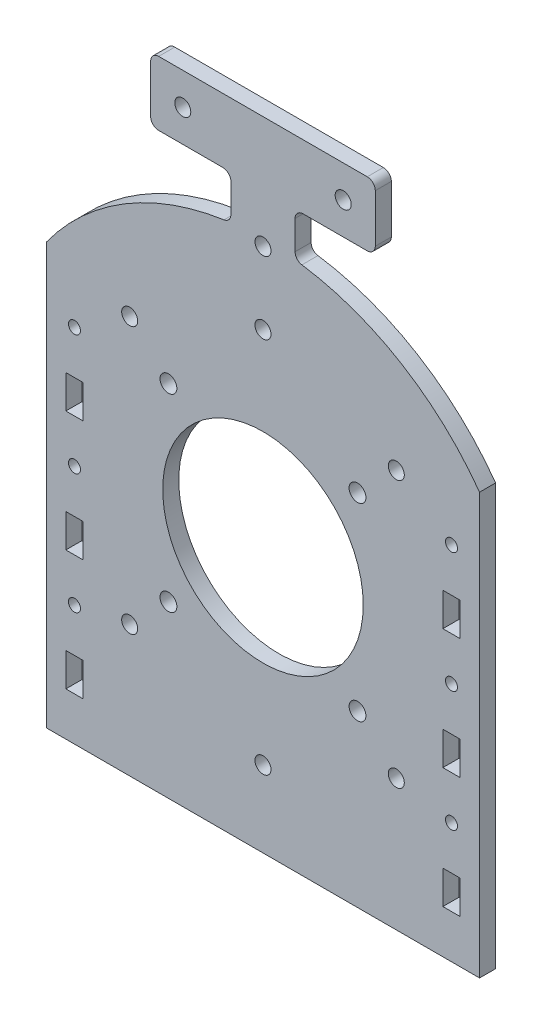
from build123d import *

# Parameters (mm, degrees)
SKETCH_1_R      = 1.5
SKETCH_1_R_2    = 2.1
SKETCH_1_R_3    = 25
SKETCH_1_R_4    = 2
SKETCH_1_W      = 4.3
SKETCH_1_H      = 8.3
EXTRUDE_1_DEPTH = 4
FILLET_1_R      = 2


with BuildPart() as part:
    # 草图1 → 凸台-拉伸1 (new body)
    with BuildSketch(Plane.XY):
        with BuildLine():
            Line((-54, 52.4), (-54, -52.5))
            Line((-54, -52.5), (54, -52.5))
            Line((54, -52.5), (54, 52.4))
            ThreePointArc((54, 52.4), (33.845954515, 70.803240423), (8, 79.569735886))
            Line((8, 79.569735886), (8, 90.5))
            Line((8, 90.5), (28, 90.5))
            Line((28, 90.5), (28, 106.5))
            Line((28, 106.5), (-28, 106.5))
            Line((-28, 106.5), (-28, 90.5))
            Line((-28, 90.5), (-8, 90.5))
            Line((-8, 90.5), (-8, 79.569735886))
            ThreePointArc((-8, 79.569735886), (-33.845954515, 70.803240423), (-54, 52.4))
        make_face()
        with Locations((-47, 37.5)):
            Circle(SKETCH_1_R, mode=Mode.SUBTRACT)
        with Locations((-47, 7.5)):
            Circle(SKETCH_1_R, mode=Mode.SUBTRACT)
        with Locations((-47, -22.5)):
            Circle(SKETCH_1_R, mode=Mode.SUBTRACT)
        with Locations((-23.57, 37.07)):
            Circle(SKETCH_1_R_2, mode=Mode.SUBTRACT)
        with Locations((-23.57, -10.07)):
            Circle(SKETCH_1_R_2, mode=Mode.SUBTRACT)
        with Locations((23.57, -10.07)):
            Circle(SKETCH_1_R_2, mode=Mode.SUBTRACT)
        with Locations((23.57, 37.07)):
            Circle(SKETCH_1_R_2, mode=Mode.SUBTRACT)
        with Locations((47, -22.5)):
            Circle(SKETCH_1_R, mode=Mode.SUBTRACT)
        with Locations((47, 7.5)):
            Circle(SKETCH_1_R, mode=Mode.SUBTRACT)
        with Locations((47, 37.5)):
            Circle(SKETCH_1_R, mode=Mode.SUBTRACT)
        with Locations((0, 13.5)):
            Circle(SKETCH_1_R_3, mode=Mode.SUBTRACT)
        with Locations((0, 60.5)):
            Circle(SKETCH_1_R_4, mode=Mode.SUBTRACT)
        with Locations((33.234018716, 46.734018716)):
            Circle(SKETCH_1_R_4, mode=Mode.SUBTRACT)
        with Locations((33.234018716, -19.734018716)):
            Circle(SKETCH_1_R_4, mode=Mode.SUBTRACT)
        with Locations((0, -33.5)):
            Circle(SKETCH_1_R_4, mode=Mode.SUBTRACT)
        with Locations((-33.234018716, -19.734018716)):
            Circle(SKETCH_1_R_4, mode=Mode.SUBTRACT)
        with Locations((-33.234018716, 46.734018716)):
            Circle(SKETCH_1_R_4, mode=Mode.SUBTRACT)
        with Locations((0, 78.5)):
            Circle(SKETCH_1_R_4, mode=Mode.SUBTRACT)
        with Locations((-20, 98.5)):
            Circle(SKETCH_1_R_4, mode=Mode.SUBTRACT)
        with Locations((20, 98.5)):
            Circle(SKETCH_1_R_4, mode=Mode.SUBTRACT)
        with Locations((-47, 22.5)):
            Rectangle(SKETCH_1_W, SKETCH_1_H, mode=Mode.SUBTRACT)
        with Locations((-47, -7.5)):
            Rectangle(SKETCH_1_W, SKETCH_1_H, mode=Mode.SUBTRACT)
        with Locations((-47, -37.5)):
            Rectangle(SKETCH_1_W, SKETCH_1_H, mode=Mode.SUBTRACT)
        with Locations((47, -37.5)):
            Rectangle(SKETCH_1_W, SKETCH_1_H, mode=Mode.SUBTRACT)
        with Locations((47, -7.5)):
            Rectangle(SKETCH_1_W, SKETCH_1_H, mode=Mode.SUBTRACT)
        with Locations((47, 22.5)):
            Rectangle(SKETCH_1_W, SKETCH_1_H, mode=Mode.SUBTRACT)
    extrude(amount=EXTRUDE_1_DEPTH)

    # 圆角1
    fillet_1_edges = [part.edges().sort_by_distance(p)[0] for p in [
        (-8, 79.569735886, 2),
        (-8, 90.5, 2),
        (-28, 90.5, 2),
        (-28, 106.5, 2),
        (28, 106.5, 2),
        (28, 90.5, 2),
        (8, 90.5, 2),
        (8, 79.569735886, 2),
    ]]
    fillet(fillet_1_edges, radius=FILLET_1_R)


solid = part.part
